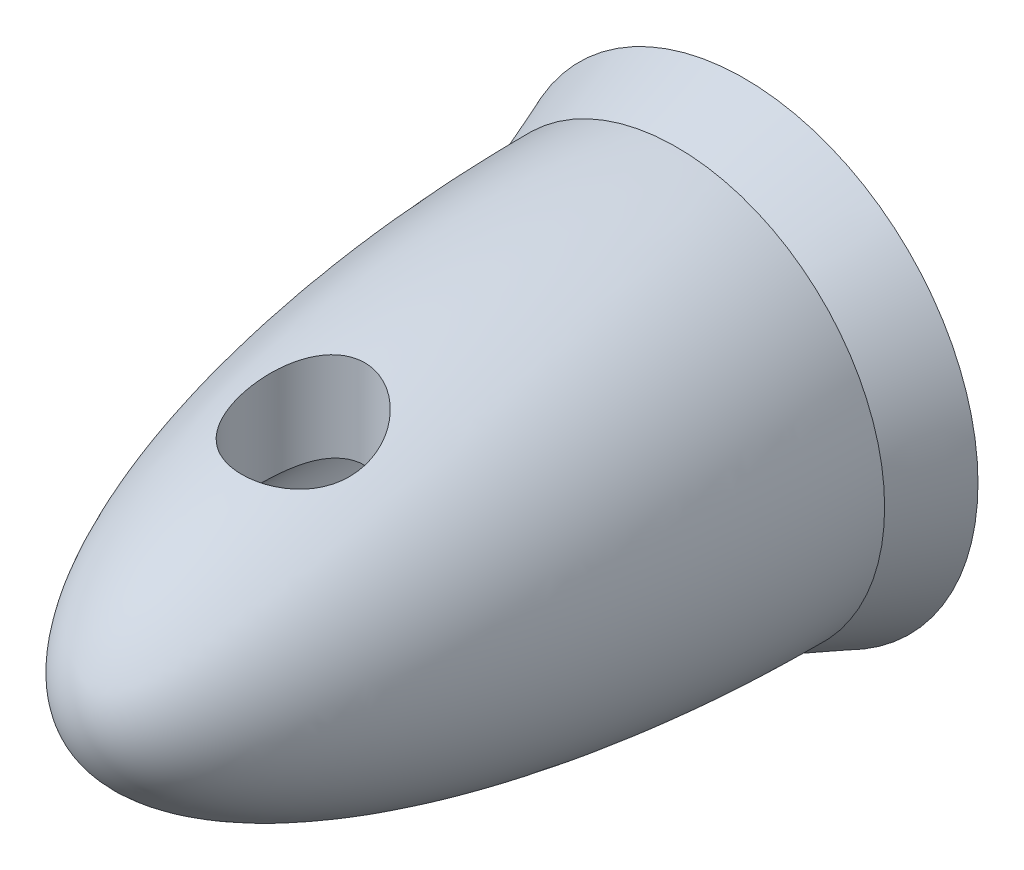
from build123d import *

# Parameters (mm, degrees)
SKETCH2_R               = 5.2324
SKETCH1_R               = 5.8801
DOME1_FACE_RADIUS       = 5.2324
DOME1_HEIGHT            = 14.986
CUT_EXTRUDE1_DEPTH      = 19.644941044
CUT_EXTRUDE1_DEPTH_BACK = 19.644941044
SKETCH3_R               = 1.5494
SKETCH4_R               = 2.2225
CUT_EXTRUDE2_DEPTH      = 14.1732


with BuildPart() as part:
    # Sketch2 → Loft1 section 0
    with BuildSketch(Plane.XY.offset(1.7018)):
        Circle(SKETCH2_R)
    # Sketch1 → Loft1 section 1
    with BuildSketch(Plane.XY):
        Circle(SKETCH1_R)
    loft()

    # Dome1: an elliptical dome of height H over a round flat face of radius A is half a spheroid: the quarter ellipse of half axes A and H revolved about the face's axis
    with BuildSketch(Plane((0, 0, 1.7018), x_dir=(0, 1, 0), z_dir=(1, 0, 0)), mode=Mode.PRIVATE) as dome1_quarter:
        Ellipse(DOME1_FACE_RADIUS, DOME1_HEIGHT)
        Rectangle(DOME1_FACE_RADIUS, DOME1_HEIGHT, align=(Align.MIN, Align.MIN), mode=Mode.INTERSECT)
    revolve(dome1_quarter.sketch, axis=Axis((0, 0, 1.7018), (0, 0, 1)))

    # Sketch3 → Cut-Extrude1 (cut, two sides: drawn at the far end of the back side and taken through both)
    with BuildSketch(Plane(origin=(0, 0, 0), x_dir=(1, 0, 0), z_dir=(0, 1, 0)).offset(-CUT_EXTRUDE1_DEPTH_BACK)):
        with Locations(Location((0, -11.0998, 0), (0, 0, 270))):
            Circle(SKETCH3_R)
    extrude(amount=CUT_EXTRUDE1_DEPTH + CUT_EXTRUDE1_DEPTH_BACK, mode=Mode.SUBTRACT)

    # Sketch4 → Cut-Extrude2 (cut)
    with BuildSketch(Plane(origin=(0, 0, 0), x_dir=(-1, 0, 0), z_dir=(0, 0, -1))):
        Circle(SKETCH4_R)
    extrude(amount=-CUT_EXTRUDE2_DEPTH, mode=Mode.SUBTRACT)


solid = part.part
